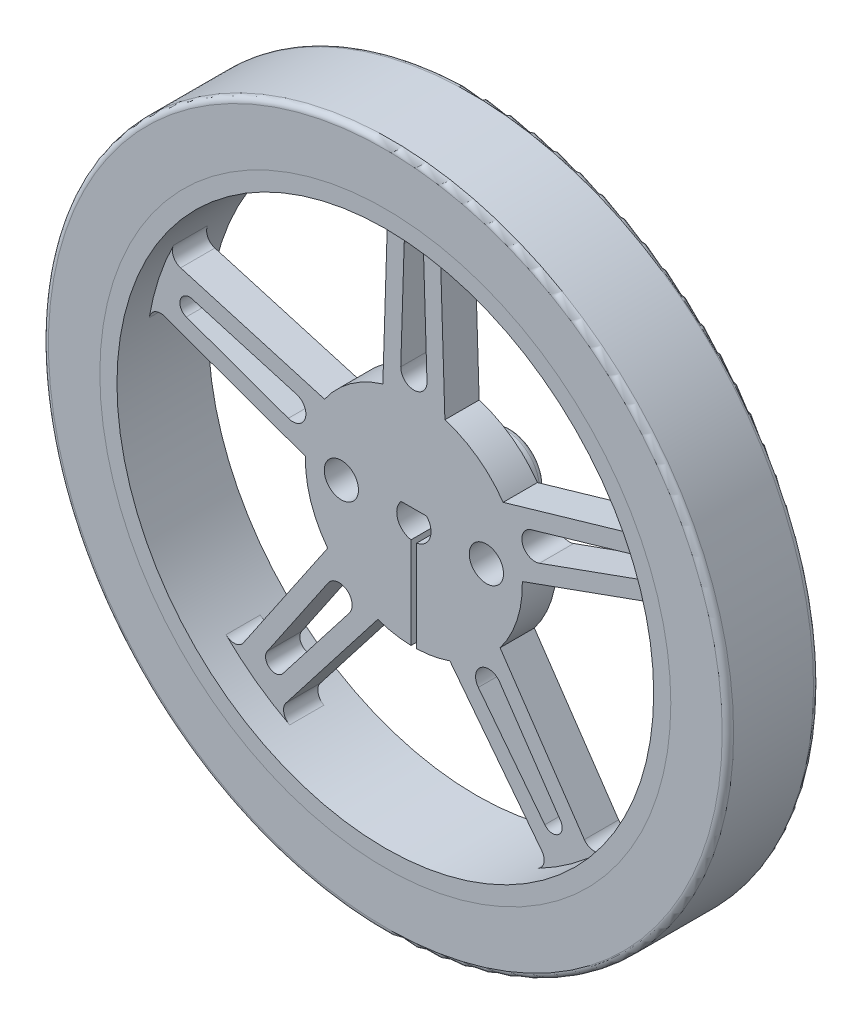
from build123d import *
from build123d.topology import SkipClean

# Parameters (mm, degrees)
ODEBRAT_VYSUNUT_M1_DEPTH = 41.5
ODEBRAT_VYSUNUT_M2_DEPTH = 41.5
SKICA6_R                 = 1.5
ODEBRAT_VYSUNUT_M3_DEPTH = 44.269504292


with BuildPart() as part:
    # Skica2 → Rotovat1 (revolve)
    with BuildSketch(Plane(origin=(0, 0, 0), x_dir=(0, 0, -1), z_dir=(1, 0, 0)), mode=Mode.PRIVATE) as rotovat1_sk:
        with BuildLine():
            Line((-1.5, 23.5), (-1.5, 0))
            Line((-1.5, 0), (7, 0))
            Line((7, 0), (7, 2.5))
            ThreePointArc((7, 2.5), (6.853553391, 2.853553391), (6.5, 3))
            Line((6.5, 3), (1.5, 3))
            Line((1.5, 3), (1.5, 23.5))
            Line((1.5, 23.5), (4, 23.5))
            Line((4, 23.5), (4, 25))
            Line((4, 25), (2.5, 25))
            Line((2.5, 25), (2.5, 28))
            Line((2.5, 28), (-2.5, 28))
            Line((-2.5, 28), (-2.5, 25))
            Line((-2.5, 25), (-4, 25))
            Line((-4, 25), (-4, 23.5))
            Line((-4, 23.5), (-1.5, 23.5))
        make_face()
    revolve(rotovat1_sk.sketch.rotate(Axis((0, 0, 36.988949001), (0, 0, -1)), 90), axis=Axis((0, 0, 36.988949001), (0, 0, -1)))

    # Skica3 → Odebrat vysunutím1 (cut, through all)
    with SkipClean():  # the faces are left unmerged after this step: merging them gives an invalid solid
        with BuildSketch(Plane.XY.offset(1.5)):
            with BuildLine():
                Line((-2.301411909, 22.224970027), (-2.715981345, 9.10348534))
                ThreePointArc((-2.715981345, 9.10348534), (-5.583959897, 7.685661447), (-7.818644661, 5.396183435))
                Line((-7.818644661, 5.396183435), (-20.426027178, 9.056666231))
                ThreePointArc((-20.426027178, 9.056666231), (-21.062953235, 9.615270945), (-21.042628673, 10.462207153))
                ThreePointArc((-21.042628673, 10.462207153), (-13.812953429, 19.011899368), (-3.447620422, 23.245728929))
                ThreePointArc((-3.447620422, 23.245728929), (-2.635855586, 23.003341054), (-2.301411909, 22.224970027))
            make_face()
            with BuildLine():
                Line((-0.849576072, 20.676842105), (-1.14942645, 11.186315789))
                ThreePointArc((-1.14942645, 11.186315789), (0, 10), (1.14942645, 11.186315789))
                Line((1.14942645, 11.186315789), (0.849576072, 20.676842105))
                ThreePointArc((0.849576072, 20.676842105), (0, 21.5), (-0.849576072, 20.676842105))
            make_face()
            with BuildLine():
                Line((2.301411909, 22.224970027), (2.715981345, 9.10348534))
                ThreePointArc((2.715981345, 9.10348534), (5.583959897, 7.685661447), (7.818644661, 5.396183435))
                Line((7.818644661, 5.396183435), (20.426027178, 9.056666231))
                ThreePointArc((20.426027178, 9.056666231), (21.062953235, 9.615270945), (21.042628673, 10.462207153))
                ThreePointArc((21.042628673, 10.462207153), (13.812953429, 19.011899368), (3.447620422, 23.245728929))
                ThreePointArc((3.447620422, 23.245728929), (2.635855586, 23.003341054), (2.301411909, 22.224970027))
            make_face()
            with BuildLine():
                Line((19.402311976, 7.197490459), (10.283626218, 4.549931198))
                ThreePointArc((10.283626218, 4.549931198), (9.510565163, 3.090169944), (10.994010832, 2.363592168))
                Line((10.994010832, 2.363592168), (19.927378865, 5.581500742))
                ThreePointArc((19.927378865, 5.581500742), (20.4477151, 6.643865379), (19.402311976, 7.197490459))
            make_face()
            with BuildLine():
                Line((21.84837796, 4.679120645), (9.497213446, 0.230079921))
                ThreePointArc((9.497213446, 0.230079921), (9.035036905, -2.935661447), (7.548169492, -5.768460568))
                Line((7.548169492, -5.768460568), (14.92539096, -16.627642472))
                ThreePointArc((14.92539096, -16.627642472), (15.653476589, -17.0607768), (16.452680154, -16.779729311))
                ThreePointArc((16.452680154, -16.779729311), (22.349828133, -7.261899368), (23.173375274, 3.904443418))
                ThreePointArc((23.173375274, 3.904443418), (22.692001577, 4.601575682), (21.84837796, 4.679120645))
            make_face()
            with BuildLine():
                Line((12.840864333, -16.228548368), (7.50505698, -8.374303662))
                ThreePointArc((7.50505698, -8.374303662), (5.877852523, -8.090169944), (5.645245917, -9.725535494))
                Line((5.645245917, -9.725535494), (11.466221374, -17.227284939))
                ThreePointArc((11.466221374, -17.227284939), (12.637382924, -17.393865379), (12.840864333, -16.228548368))
            make_face()
            with BuildLine():
                Line((11.201628269, -19.333114431), (3.153619362, -8.961288128))
                ThreePointArc((3.153619362, -8.961288128), (0, -9.5), (-3.153619362, -8.961288128))
                Line((-3.153619362, -8.961288128), (-11.201628269, -19.333114431))
                ThreePointArc((-11.201628269, -19.333114431), (-11.388572661, -20.159410881), (-10.874313132, -20.832650189))
                ThreePointArc((-10.874313132, -20.832650189), (0, -23.5), (10.874313132, -20.832650189))
                ThreePointArc((10.874313132, -20.832650189), (11.388572661, -20.159410881), (11.201628269, -19.333114431))
            make_face()
            with BuildLine():
                Line((-11.466221374, -17.227284939), (-5.645245917, -9.725535494))
                ThreePointArc((-5.645245917, -9.725535494), (-5.877852523, -8.090169944), (-7.50505698, -8.374303662))
                Line((-7.50505698, -8.374303662), (-12.840864333, -16.228548368))
                ThreePointArc((-12.840864333, -16.228548368), (-12.637382924, -17.393865379), (-11.466221374, -17.227284939))
            make_face()
            with BuildLine():
                Line((-14.92539096, -16.627642472), (-7.548169492, -5.768460568))
                ThreePointArc((-7.548169492, -5.768460568), (-9.035036905, -2.935661447), (-9.497213446, 0.230079921))
                Line((-9.497213446, 0.230079921), (-21.84837796, 4.679120645))
                ThreePointArc((-21.84837796, 4.679120645), (-22.692001577, 4.601575682), (-23.173375274, 3.904443418))
                ThreePointArc((-23.173375274, 3.904443418), (-22.349828133, -7.261899368), (-16.452680154, -16.779729311))
                ThreePointArc((-16.452680154, -16.779729311), (-15.653476589, -17.0607768), (-14.92539096, -16.627642472))
            make_face()
            with BuildLine():
                Line((-19.927378865, 5.581500742), (-10.994010832, 2.363592168))
                ThreePointArc((-10.994010832, 2.363592168), (-9.510565163, 3.090169944), (-10.283626218, 4.549931198))
                Line((-10.283626218, 4.549931198), (-19.402311976, 7.197490459))
                ThreePointArc((-19.402311976, 7.197490459), (-20.4477151, 6.643865379), (-19.927378865, 5.581500742))
            make_face()
        extrude(amount=-ODEBRAT_VYSUNUT_M1_DEPTH, mode=Mode.SUBTRACT)

    # Skica4 → Odebrat vysunutím2 (cut, through all)
    with SkipClean():  # the faces are left unmerged after this step: merging them gives an invalid solid
        with BuildSketch(Plane.XY.offset(1.5)):
            with BuildLine():
                Line((-1.118033989, 1), (1.118033989, 1))
                ThreePointArc((1.118033989, 1), (1.41572039, -0.495717438), (0.25, -1.479019946))
                Line((0.25, -1.479019946), (0.25, -13.718786792))
                Line((0.25, -13.718786792), (-0.25, -13.718786792))
                Line((-0.25, -13.718786792), (-0.25, -1.479019946))
                ThreePointArc((-0.25, -1.479019946), (-1.41572039, -0.495717438), (-1.118033989, 1))
            make_face()
        extrude(amount=-ODEBRAT_VYSUNUT_M2_DEPTH, mode=Mode.SUBTRACT)

    # Skica6 → Odebrat vysunutím3 (cut, through all)
    with SkipClean():  # the faces are left unmerged after this step: merging them gives an invalid solid
        with BuildSketch(Plane.XY.offset(1.5)):
            with Locations((-6.35, 0)):
                Circle(SKICA6_R)
            with Locations((6.35, 0)):
                Circle(SKICA6_R)
        extrude(amount=-ODEBRAT_VYSUNUT_M3_DEPTH, mode=Mode.SUBTRACT)


with BuildPart() as body_2:
    # Skica5 → Rotovat2 (revolve)
    with BuildSketch(Plane(origin=(0, 0, 0), x_dir=(0, 0, -1), z_dir=(1, 0, 0)), mode=Mode.PRIVATE) as rotovat2_sk:
        with BuildLine():
            Line((-4, 25), (-4, 29.5))
            ThreePointArc((-4, 29.5), (-3.853553391, 29.853553391), (-3.5, 30))
            Line((-3.5, 30), (3.5, 30))
            ThreePointArc((3.5, 30), (3.853553391, 29.853553391), (4, 29.5))
            Line((4, 29.5), (4, 25))
            Line((4, 25), (2.5, 25))
            Line((2.5, 25), (2.5, 28))
            Line((2.5, 28), (-2.5, 28))
            Line((-2.5, 28), (-2.5, 25))
            Line((-2.5, 25), (-4, 25))
        make_face()
    revolve(rotovat2_sk.sketch.rotate(Axis((0, 0, 0), (0, 0, -1)), 90), axis=Axis((0, 0, 0), (0, 0, -1)))


solid = Compound([part.part, body_2.part])
